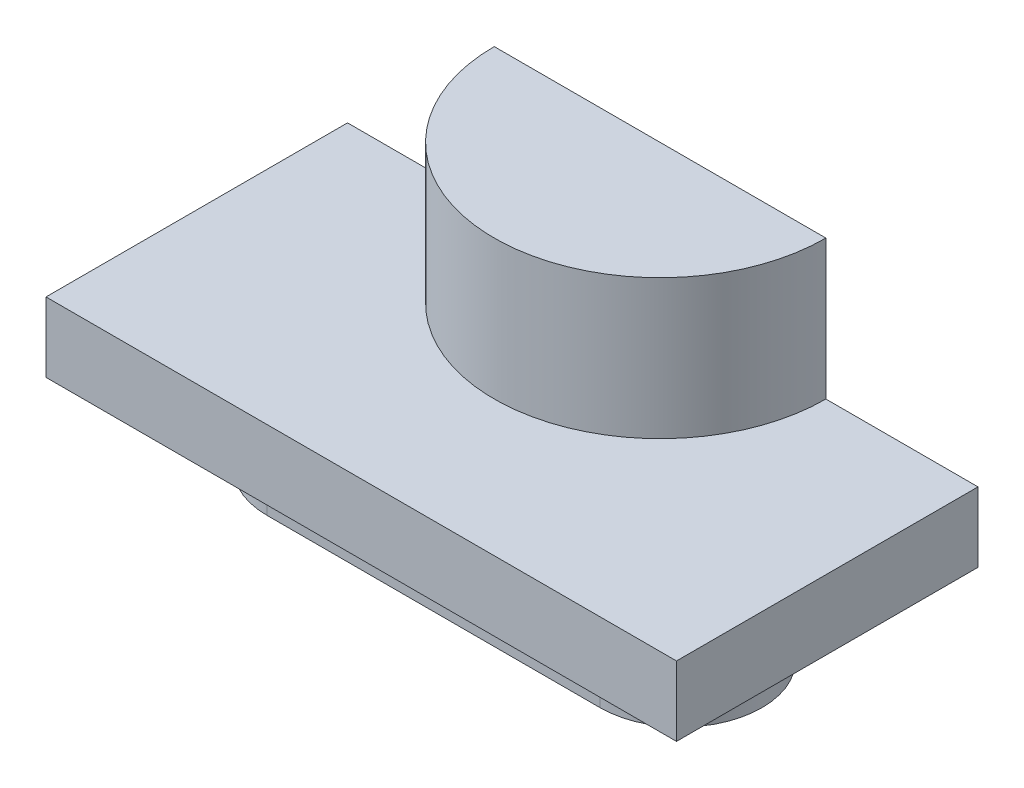
from build123d import *

# Parameters (mm, degrees)
SKETCH_1_W      = 90.450741223
SKETCH_1_H      = 43.255156446
EXTRUDE_1_DEPTH = 10
EXTRUDE_2_DEPTH = 20
EXTRUDE_3_DEPTH = 10


with BuildPart() as part:
    # 草图1 → 凸台-拉伸1 (new body)
    with BuildSketch(Plane(origin=(0, 0, 0), x_dir=(1, 0, 0), z_dir=(0, 1, 0))):
        with Locations((45.225370612, 21.627578223)):
            Rectangle(SKETCH_1_W, SKETCH_1_H)
    extrude(amount=EXTRUDE_1_DEPTH)

    # 草图2 → 凸台-拉伸2 (add)
    with BuildSketch(Plane(origin=(0, 10, 0), x_dir=(1, 0, 0), z_dir=(0, 1, 0))):
        with BuildLine():
            Line((68.630258788, 43.255156446), (21.047365446, 43.255156446))
            ThreePointArc((21.047365446, 43.255156446), (44.838812117, 19.463709775), (68.630258788, 43.255156446))
        make_face()
    extrude(amount=EXTRUDE_2_DEPTH)

    # 草图3 → 凸台-拉伸3 (add)
    with BuildSketch(Plane.XZ):
        with BuildLine():
            Line((22.99825717, -8.71008186), (70.802657673, -8.71008186))
            ThreePointArc((70.802657673, -8.71008186), (82.399412512, -20.3068367), (70.802657673, -31.903591539))
            Line((70.802657673, -31.903591539), (22.99825717, -31.903591539))
            ThreePointArc((22.99825717, -31.903591539), (11.40150233, -20.3068367), (22.99825717, -8.71008186))
        make_face()
    extrude(amount=EXTRUDE_3_DEPTH)


solid = part.part
